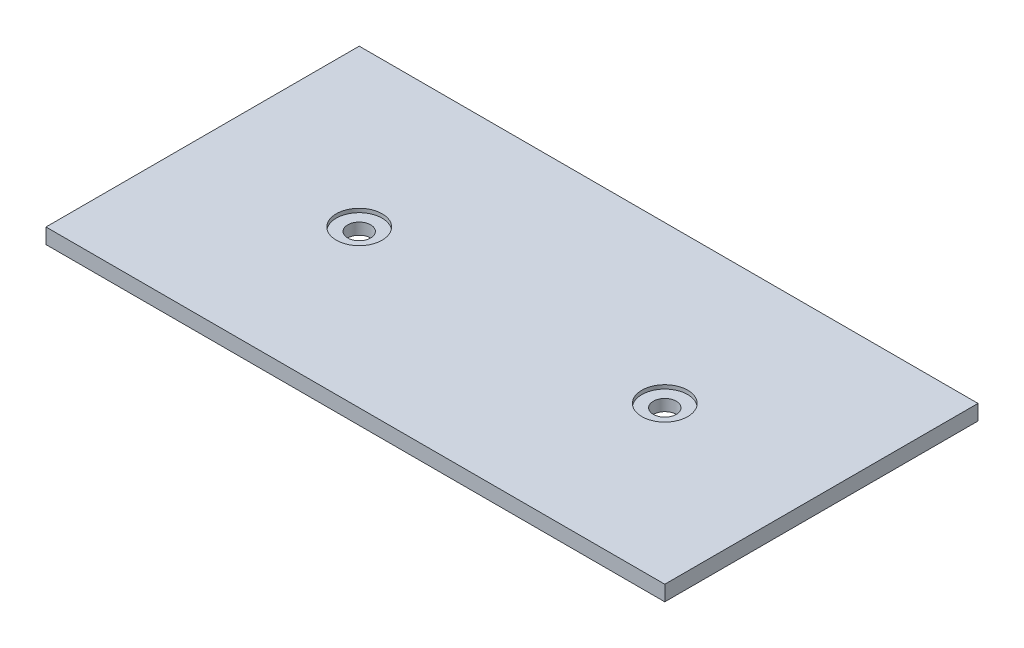
from build123d import *

# Parameters (mm, degrees)
SKETCH1_W           = 81
SKETCH1_H           = 41
BOSS_EXTRUDE1_DEPTH = 2
SKETCH2_R           = 3
CUT_EXTRUDE1_DEPTH  = 0.5
SKETCH3_R           = 1.5
CUT_EXTRUDE2_DEPTH  = 91.797852398
SKETCH4_R           = 3
BOSS_EXTRUDE2_DEPTH = 2


with BuildPart() as part:
    # Sketch1 → Boss-Extrude1 (new body)
    with BuildSketch(Plane(origin=(0, 0, 0), x_dir=(1, 0, 0), z_dir=(0, 1, 0))):
        with Locations((40.5, 20.5)):
            Rectangle(SKETCH1_W, SKETCH1_H)
    extrude(amount=BOSS_EXTRUDE1_DEPTH)

    # Sketch2 → Cut-Extrude1 (cut)
    with BuildSketch(Plane(origin=(0, 2, 0), x_dir=(1, 0, 0), z_dir=(0, 1, 0))):
        with Locations(Location((20.5, 20.5, 0), (0, 0, 270))):
            Circle(SKETCH2_R)
        with Locations(Location((60.5, 20.5, 0), (0, 0, 270))):
            Circle(SKETCH2_R)
    extrude(amount=-CUT_EXTRUDE1_DEPTH, mode=Mode.SUBTRACT)

    # Sketch3 → Cut-Extrude2 (cut, through all)
    with BuildSketch(Plane(origin=(0, 1.5, 0), x_dir=(1, 0, 0), z_dir=(0, 1, 0))):
        with Locations(Location((20.5, 20.5, 0), (0, 0, 270))):
            Circle(SKETCH3_R)
        with Locations(Location((60.5, 20.5, 0), (0, 0, 270))):
            Circle(SKETCH3_R)
    extrude(amount=-CUT_EXTRUDE2_DEPTH, mode=Mode.SUBTRACT)

    # Sketch4 → Boss-Extrude2 (add)
    with BuildSketch(Plane.XZ):
        with Locations(Location((70.5, -30.5, 0), (0, 0, 270))):
            Circle(SKETCH4_R)
        with Locations(Location((50.5, -30.5, 0), (0, 0, 270))):
            Circle(SKETCH4_R)
        with Locations(Location((30.5, -30.5, 0), (0, 0, 270))):
            Circle(SKETCH4_R)
        with Locations(Location((10.5, -30.5, 0), (0, 0, 270))):
            Circle(SKETCH4_R)
        with Locations(Location((50.5, -10.5, 0), (0, 0, 270))):
            Circle(SKETCH4_R)
        with Locations(Location((30.5, -10.5, 0), (0, 0, 270))):
            Circle(SKETCH4_R)
        with Locations(Location((10.5, -10.5, 0), (0, 0, 270))):
            Circle(SKETCH4_R)
        with Locations(Location((70.5, -10.5, 0), (0, 0, 270))):
            Circle(SKETCH4_R)
    extrude(amount=BOSS_EXTRUDE2_DEPTH)


solid = part.part
